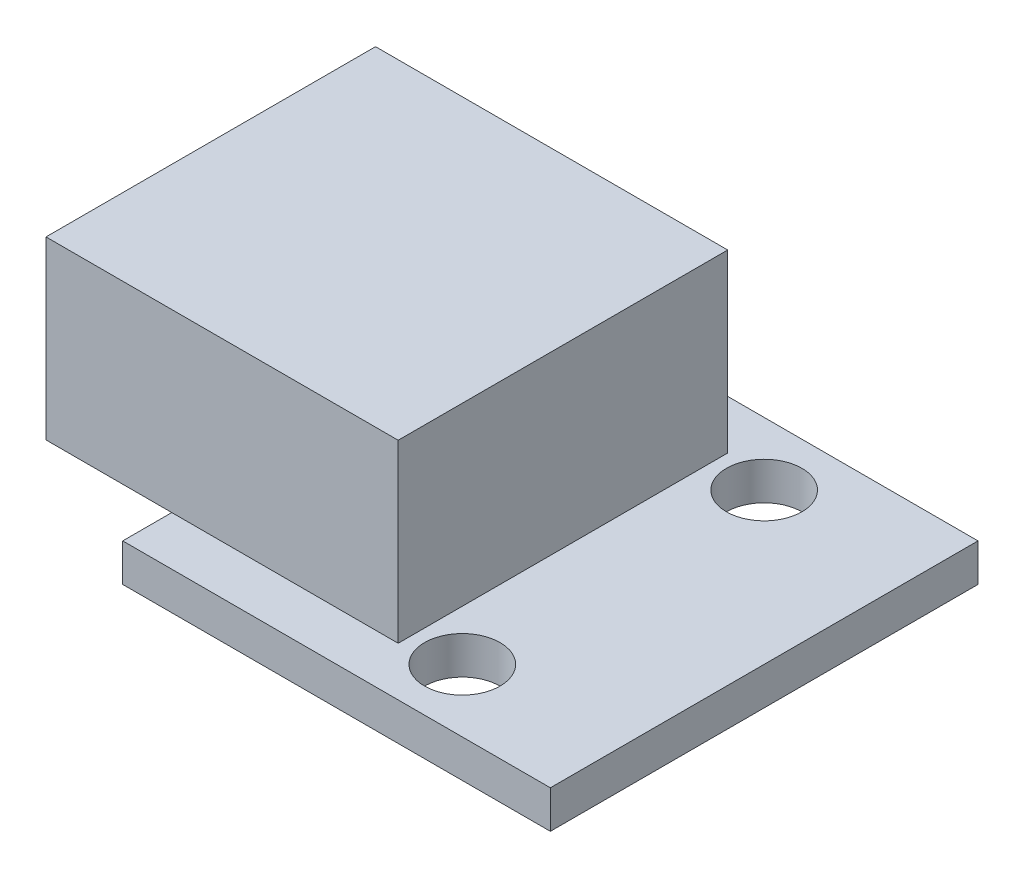
from build123d import *

# Parameters (mm, degrees)
SKETCH1_W           = 17
SKETCH1_H           = 17
SKETCH1_R           = 1.5
BOSS_EXTRUDE1_DEPTH = 1.5
SKETCH2_W           = 14
SKETCH2_H           = 13.1
BOSS_EXTRUDE2_DEPTH = 6.99


with BuildPart() as part:
    # Sketch1 → Boss-Extrude1 (new body)
    with BuildSketch(Plane(origin=(0, 0, 0), x_dir=(1, 0, 0), z_dir=(0, 1, 0))):
        Rectangle(SKETCH1_W, SKETCH1_H)
        with Locations(Location((2.5, 6, 0), (0, 0, 270))):
            Circle(SKETCH1_R, mode=Mode.SUBTRACT)
        with Locations(Location((2.5, -6, 0), (0, 0, 270))):
            Circle(SKETCH1_R, mode=Mode.SUBTRACT)
    extrude(amount=BOSS_EXTRUDE1_DEPTH)

    # Sketch2 → Boss-Extrude2 (add)
    with BuildSketch(Plane(origin=(0, 1.5, 0), x_dir=(1, 0, 0), z_dir=(0, 1, 0))):
        with Locations((-6.5, 0)):
            Rectangle(SKETCH2_W, SKETCH2_H)
    extrude(amount=BOSS_EXTRUDE2_DEPTH)


solid = part.part
